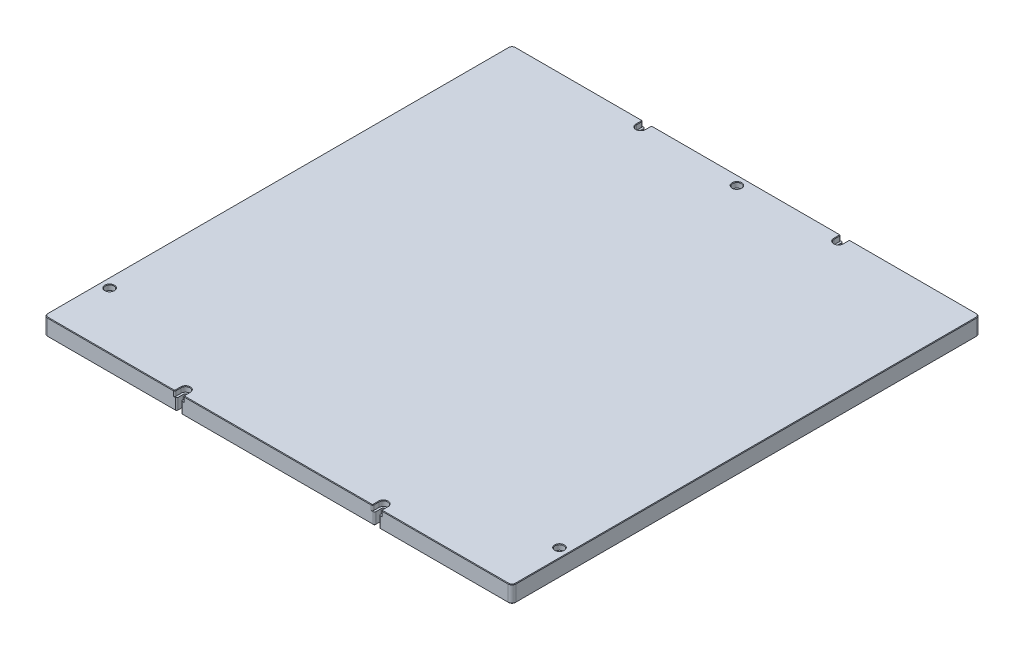
from build123d import *

# Parameters (mm, degrees)
SKETCH1_W                                           = 355
SKETCH1_H                                           = 355
BOSS_EXTRUDE1_DEPTH                                 = 12.7
CBORE_FOR_M3_HEX_SOCKET_HEAD_CAP_SCREW1_D           = 3.4
CBORE_FOR_M3_HEX_SOCKET_HEAD_CAP_SCREW1_CBORE_D     = 6.5
CBORE_FOR_M3_HEX_SOCKET_HEAD_CAP_SCREW1_CBORE_DEPTH = 4
CUT_EXTRUDE1_DEPTH                                  = 252.343967503
CUT_EXTRUDE2_DEPTH                                  = 4
FILLET2_R                                           = 1
SKETCH5_R                                           = 1.7
CUT_EXTRUDE3_DEPTH                                  = 6
FILLET1_R                                           = 3
CHAMFER1_SIZE                                       = 0.4


with BuildPart() as part:
    # Sketch1 → Boss-Extrude1 (new body)
    with BuildSketch(Plane(origin=(0, 0, 0), x_dir=(1, 0, 0), z_dir=(0, 1, 0))):
        Rectangle(SKETCH1_W, SKETCH1_H)
    extrude(amount=-BOSS_EXTRUDE1_DEPTH)

    # CBORE for M3 Hex Socket Head Cap Screw1 (through all)
    with Locations(Plane(origin=(0, 0, 0), x_dir=(1, 0, 0), z_dir=(0, 1, 0))):
        with Locations((-170.5, -134.5), (170.5, -134.5), (0, 170.5)):
            CounterBoreHole(CBORE_FOR_M3_HEX_SOCKET_HEAD_CAP_SCREW1_D / 2, CBORE_FOR_M3_HEX_SOCKET_HEAD_CAP_SCREW1_CBORE_D / 2, CBORE_FOR_M3_HEX_SOCKET_HEAD_CAP_SCREW1_CBORE_DEPTH)

    # Sketch4 → Cut-Extrude1 (cut, through all)
    with BuildSketch(Plane(origin=(0, 0, 0), x_dir=(1, 0, 0), z_dir=(0, 1, 0))):
        with BuildLine():
            Line((-76.7, -172.5), (-76.7, -177.5))
            Line((-76.7, -177.5), (-73.3, -177.5))
            Line((-73.3, -177.5), (-73.3, -172.5))
            ThreePointArc((-73.3, -172.5), (-75, -170.8), (-76.7, -172.5))
        make_face()
        with BuildLine():
            Line((73.3, -172.5), (73.3, -177.5))
            Line((73.3, -177.5), (76.7, -177.5))
            Line((76.7, -177.5), (76.7, -172.5))
            ThreePointArc((76.7, -172.5), (75, -170.8), (73.3, -172.5))
        make_face()
        with BuildLine():
            Line((-73.3, 177.5), (-76.7, 177.5))
            Line((-76.7, 177.5), (-76.7, 172.5))
            ThreePointArc((-76.7, 172.5), (-75, 170.8), (-73.3, 172.5))
            Line((-73.3, 172.5), (-73.3, 177.5))
        make_face()
        with BuildLine():
            Line((76.7, 177.5), (73.3, 177.5))
            Line((73.3, 177.5), (73.3, 172.5))
            ThreePointArc((73.3, 172.5), (75, 170.8), (76.7, 172.5))
            Line((76.7, 172.5), (76.7, 177.5))
        make_face()
    extrude(amount=-CUT_EXTRUDE1_DEPTH, mode=Mode.SUBTRACT)

    # Sketch4<3> → Cut-Extrude2 (cut)
    # profile 1 of 4: a face of its own
    with BuildSketch(Plane(origin=(0, 0, 0), x_dir=(1, 0, 0), z_dir=(0, 1, 0))):
        with BuildLine():
            Line((-78.25, -172.5), (-78.25, -179.05))
            Line((-78.25, -179.05), (-71.75, -179.05))
            Line((-71.75, -179.05), (-71.75, -172.5))
            ThreePointArc((-71.75, -172.5), (-75, -169.25), (-78.25, -172.5))
        make_face()
        with BuildLine():
            Line((-73.3, -177.5), (-76.7, -177.5))
            Line((-76.7, -177.5), (-76.7, -172.5))
            ThreePointArc((-76.7, -172.5), (-75, -170.8), (-73.3, -172.5))
            Line((-73.3, -172.5), (-73.3, -177.5))
        make_face(mode=Mode.SUBTRACT)
    # profile 2 of 4: a face of its own
    with BuildSketch(Plane(origin=(0, 0, 0), x_dir=(1, 0, 0), z_dir=(0, 1, 0))):
        with BuildLine():
            Line((71.75, -172.5), (71.75, -179.05))
            Line((71.75, -179.05), (78.25, -179.05))
            Line((78.25, -179.05), (78.25, -172.5))
            ThreePointArc((78.25, -172.5), (75, -169.25), (71.75, -172.5))
        make_face()
        with BuildLine():
            Line((76.7, -177.5), (73.3, -177.5))
            Line((73.3, -177.5), (73.3, -172.5))
            ThreePointArc((73.3, -172.5), (75, -170.8), (76.7, -172.5))
            Line((76.7, -172.5), (76.7, -177.5))
        make_face(mode=Mode.SUBTRACT)
    # profile 3 of 4: a face of its own
    with BuildSketch(Plane(origin=(0, 0, 0), x_dir=(1, 0, 0), z_dir=(0, 1, 0))):
        with BuildLine():
            Line((78.25, 179.05), (71.75, 179.05))
            Line((71.75, 179.05), (71.75, 172.5))
            ThreePointArc((71.75, 172.5), (75, 169.25), (78.25, 172.5))
            Line((78.25, 172.5), (78.25, 179.05))
        make_face()
        with BuildLine():
            Line((73.3, 172.5), (73.3, 177.5))
            Line((73.3, 177.5), (76.7, 177.5))
            Line((76.7, 177.5), (76.7, 172.5))
            ThreePointArc((76.7, 172.5), (75, 170.8), (73.3, 172.5))
        make_face(mode=Mode.SUBTRACT)
    # profile 4 of 4: a face of its own
    with BuildSketch(Plane(origin=(0, 0, 0), x_dir=(1, 0, 0), z_dir=(0, 1, 0))):
        with BuildLine():
            ThreePointArc((-78.25, 172.5), (-75, 169.25), (-71.75, 172.5))
            Line((-71.75, 172.5), (-71.75, 179.05))
            Line((-71.75, 179.05), (-78.25, 179.05))
            Line((-78.25, 179.05), (-78.25, 172.5))
        make_face()
        with BuildLine():
            Line((-76.7, 172.5), (-76.7, 177.5))
            Line((-76.7, 177.5), (-73.3, 177.5))
            Line((-73.3, 177.5), (-73.3, 172.5))
            ThreePointArc((-73.3, 172.5), (-75, 170.8), (-76.7, 172.5))
        make_face(mode=Mode.SUBTRACT)
    extrude(amount=-CUT_EXTRUDE2_DEPTH, mode=Mode.SUBTRACT)

    # Fillet2
    fillet2_edges = [part.edges().sort_by_distance(p)[0] for p in [
        (-71.75, -2, 177.5),
        (-73.3, -8.35, 177.5),
        (-76.7, -8.35, 177.5),
        (-78.25, -2, 177.5),
        (-73.3, -8.35, -177.5),
        (-76.7, -8.35, -177.5),
        (-78.25, -2, -177.5),
        (-71.75, -2, -177.5),
        (71.75, -2, -177.5),
        (73.3, -8.35, -177.5),
        (76.7, -8.35, -177.5),
        (78.25, -2, -177.5),
        (76.7, -8.35, 177.5),
        (78.25, -2, 177.5),
        (73.3, -8.35, 177.5),
        (71.75, -2, 177.5),
    ]]
    fillet(fillet2_edges, radius=FILLET2_R)

    # Sketch5 → Cut-Extrude3 (cut)
    with BuildSketch(Plane.XZ.offset(12.7)):
        with Locations((-37.5, -170.5)):
            Circle(SKETCH5_R)
        with Locations((37.5, -170.5)):
            Circle(SKETCH5_R)
        with Locations((0, -170.5)):
            Circle(SKETCH5_R)
    extrude(amount=-CUT_EXTRUDE3_DEPTH, mode=Mode.SUBTRACT)

    # Fillet1
    fillet1_edges = [part.edges().sort_by_distance(p)[0] for p in [
        (177.5, -6.35, -177.5),
        (-177.5, -6.35, -177.5),
        (177.5, -6.35, 177.5),
        (-177.5, -6.35, 177.5),
    ]]
    fillet(fillet1_edges, radius=FILLET1_R)

    # Chamfer1
    chamfer1_edges = [part.edges().sort_by_distance(p)[0] for p in [
        (-3.25, 0, -170.5),
        (167.25, 0, 134.5),
        (-173.75, 0, 134.5),
        (176.621320344, 0, 176.621320344),
        (126.875, 0, 177.5),
        (78.542893219, 0, 177.207106781),
        (78.25, 0, 174.5),
        (75, 0, 169.25),
        (71.75, 0, 174.5),
        (71.457106781, 0, 177.207106781),
        (0, 0, 177.5),
        (-71.457106781, 0, 177.207106781),
        (-71.75, 0, 174.5),
        (-75, 0, 169.25),
        (-78.25, 0, 174.5),
        (-78.542893219, 0, 177.207106781),
        (-126.875, 0, 177.5),
        (-176.621320344, 0, 176.621320344),
        (-177.5, 0, 0),
        (-176.621320344, 0, -176.621320344),
        (-126.875, 0, -177.5),
        (-78.542893219, 0, -177.207106781),
        (-78.25, 0, -174.5),
        (-75, 0, -169.25),
        (-71.75, 0, -174.5),
        (-71.457106781, 0, -177.207106781),
        (0, 0, -177.5),
        (71.457106781, 0, -177.207106781),
        (71.75, 0, -174.5),
        (75, 0, -169.25),
        (78.25, 0, -174.5),
        (78.542893219, 0, -177.207106781),
        (126.875, 0, -177.5),
        (176.621320344, 0, -176.621320344),
        (177.5, 0, 0),
        (76.992893219, -12.7, -177.207106781),
        (76.7, -12.7, -174.5),
        (75, -12.7, -170.8),
        (73.3, -12.7, -174.5),
        (73.007106781, -12.7, -177.207106781),
        (0, -12.7, -177.5),
        (-73.007106781, -12.7, -177.207106781),
        (-73.3, -12.7, -174.5),
        (-75, -12.7, -170.8),
        (-76.7, -12.7, -174.5),
        (-76.992893219, -12.7, -177.207106781),
        (-126.1, -12.7, -177.5),
        (-176.621320344, -12.7, -176.621320344),
        (-177.5, -12.7, 0),
        (-176.621320344, -12.7, 176.621320344),
        (-126.1, -12.7, 177.5),
        (-76.992893219, -12.7, 177.207106781),
        (-76.7, -12.7, 174.5),
        (-75, -12.7, 170.8),
        (-73.3, -12.7, 174.5),
        (-73.007106781, -12.7, 177.207106781),
        (0, -12.7, 177.5),
        (73.007106781, -12.7, 177.207106781),
        (73.3, -12.7, 174.5),
        (75, -12.7, 170.8),
        (76.7, -12.7, 174.5),
        (76.992893219, -12.7, 177.207106781),
        (126.1, -12.7, 177.5),
        (176.621320344, -12.7, 176.621320344),
        (177.5, -12.7, 0),
        (176.621320344, -12.7, -176.621320344),
        (126.1, -12.7, -177.5),
        (1.7, -12.7, -170.5),
        (172.2, -12.7, 134.5),
        (-168.8, -12.7, 134.5),
        (35.8, -12.7, -170.5),
        (-39.2, -12.7, -170.5),
    ]]
    chamfer(chamfer1_edges, length=CHAMFER1_SIZE)


solid = part.part
